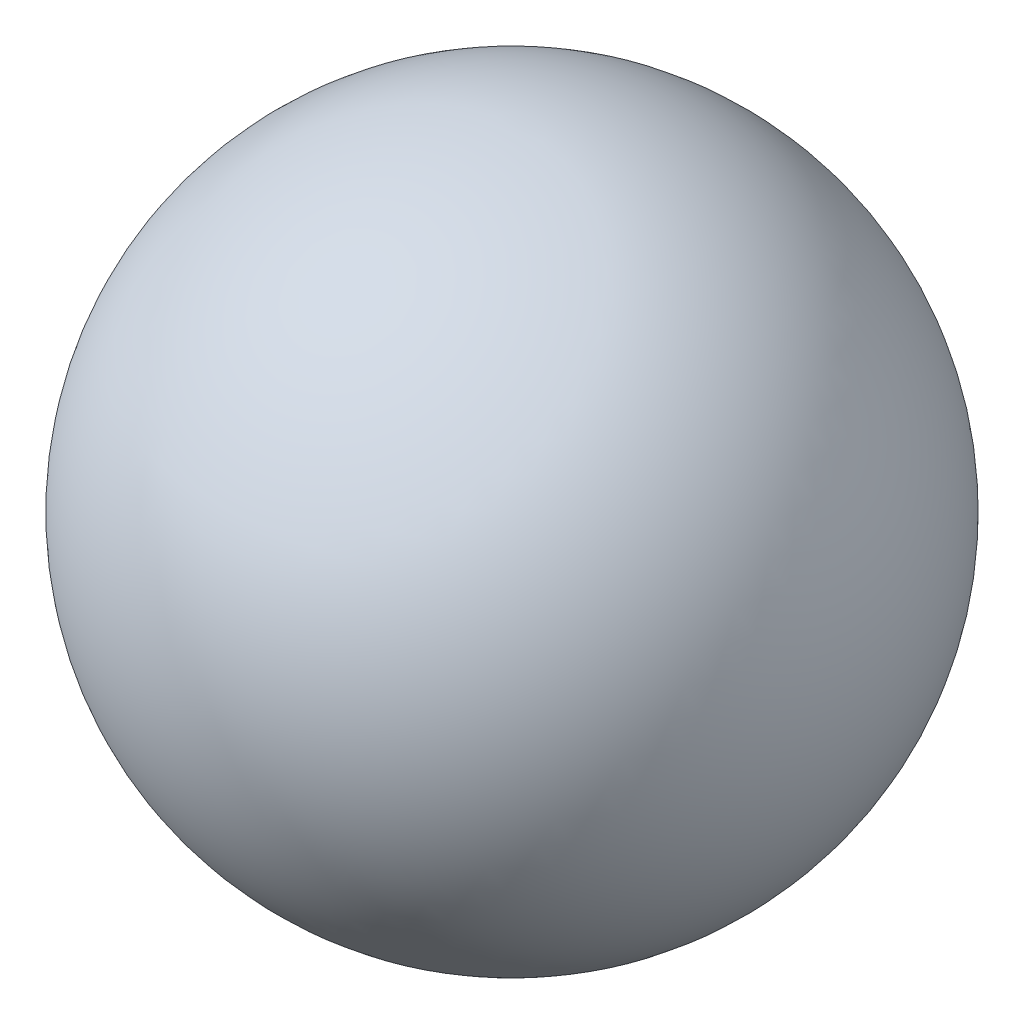
from build123d import *


with BuildPart() as part:
    # Sketch1 → Revolve1 (revolve)
    with BuildSketch(Plane.XY):
        with BuildLine():
            Line((-1272.513168316, -243.784428866), (-1272.513168316, 2156.215571134))
            ThreePointArc((-1272.513168316, 2156.215571134), (-72.513168316, 956.215571134), (-1272.513168316, -243.784428866))
        make_face()
    revolve(axis=Axis((-1272.513168316, -243.784428866, 0), (0, 1, 0)))


solid = part.part
